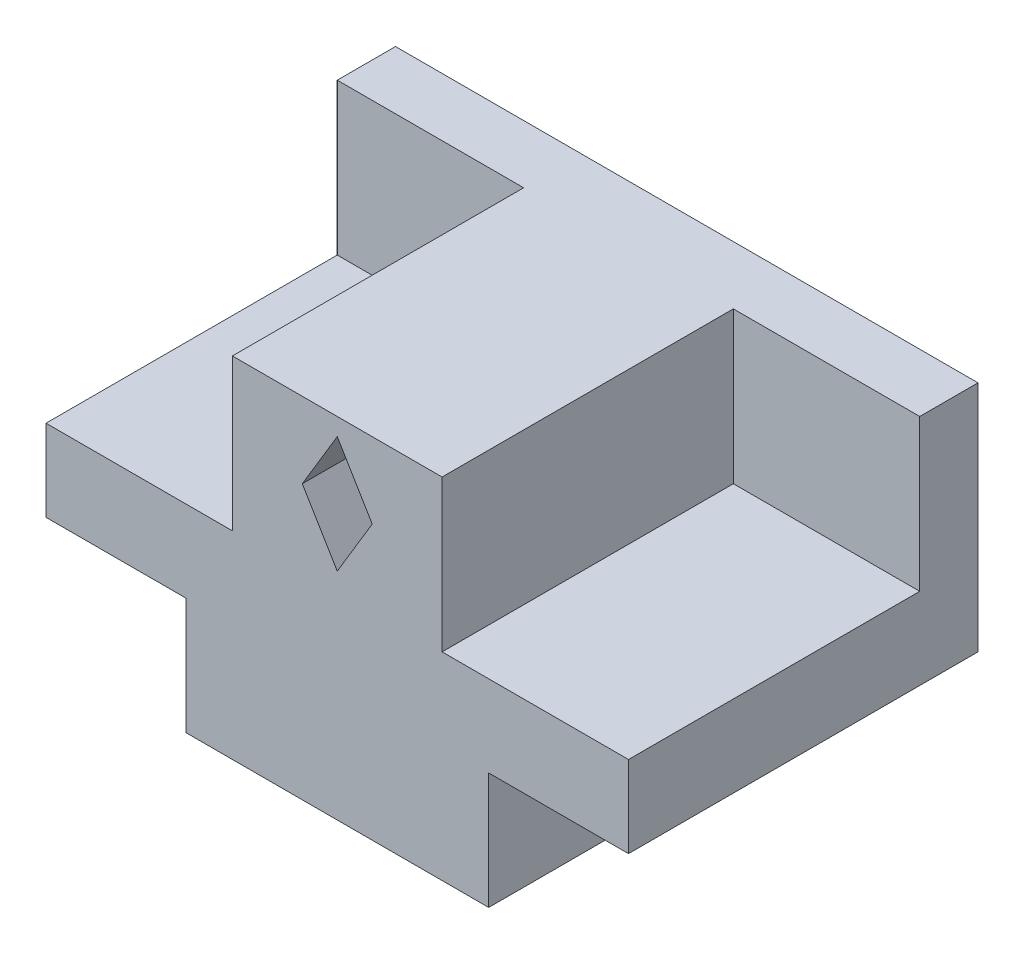
from build123d import *

# Parameters (mm, degrees)
EXTRUDE_1_DEPTH = 30
SKETCH_2_W      = 50
SKETCH_2_H      = 20
EXTRUDE_2_DEPTH = 5


with BuildPart() as part:
    # Эскиз1 → Бобышка-Вытянуть1 (new body)
    with BuildSketch(Plane.XY):
        Polygon((9, 17), (9, 23.5), (3, 23.5), (0, 18.5), (0, 0), (13, 0), (13, 10), (25, 10), (25, 17), align=None)
        Polygon((3, 23.5), (9, 23.5), (9, 30), (0, 30), (0, 28.5), align=None)
    extrude_1 = extrude(amount=EXTRUDE_1_DEPTH)

    # Зеркальное отражение1: Бобышка-Вытянуть1 across plane
    add(extrude_1.mirror(Plane(origin=(0, 0, 30), x_dir=(0, 0, 1), z_dir=(-1, 0, 0))))

    # Эскиз2 → Бобышка-Вытянуть2 (add)
    with BuildSketch(Plane(origin=(0, 0, 0), x_dir=(-1, 0, 0), z_dir=(0, 0, -1))):
        with Locations((0, 20)):
            Rectangle(SKETCH_2_W, SKETCH_2_H)
        Polygon((0, 28.5), (3, 23.5), (0, 18.5), (-3, 23.5), align=None, mode=Mode.SUBTRACT)
    extrude(amount=-EXTRUDE_2_DEPTH)


solid = part.part
